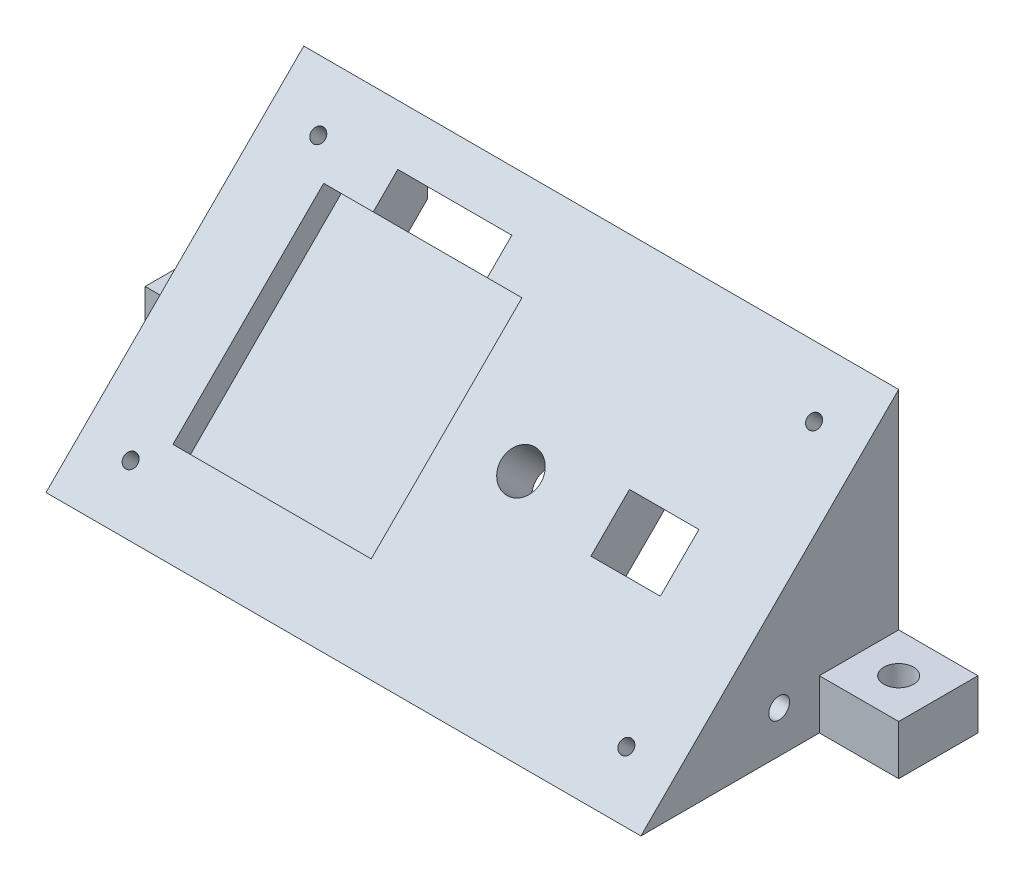
from build123d import *

# Parameters (mm, degrees)
EXTRUDE_3_DEPTH          = 120
SKETCH_4_R               = 4
SKETCH_4_W               = 14
SKETCH_4_H               = 11
CUT_EXTRUDE_1_DEPTH      = 120
CUT_EXTRUDE_2_DEPTH      = 5
SKETCH_5_W               = 23
SKETCH_5_H               = 7
CUT_EXTRUDE_3_DEPTH      = 98
SKETCH_6_W               = 100
SKETCH_6_H               = 53.539105243
CUT_EXTRUDE_4_DEPTH      = 98
SKETCH_7_R               = 1.4
CUT_EXTRUDE_5_DEPTH      = 5
SKETCH_13_W              = 16
SKETCH_13_H              = 16
SKETCH_13_R              = 3
EXTRUDE_8_DEPTH          = 10
CUT_EXTRUDE_7_DEPTH      = 155.609184721
CUT_EXTRUDE_7_DEPTH_BACK = 155.609184721
SKETCH_15_R              = 2.1


with BuildPart() as part:
    # Эскиз3 → Бобышка-Вытянуть3 (new body)
    with BuildSketch(Plane(origin=(0, 0, 0), x_dir=(0, 0, -1), z_dir=(1, 0, 0))):
        Polygon((0, 0), (52, 0), (52, 52), align=None)
    extrude(amount=EXTRUDE_3_DEPTH)

    # Эскиз4 → Вырез-Вытянуть1 (cut)
    with BuildSketch(Plane(origin=(0, 0, 0), x_dir=(1, 0, 0), z_dir=(0, 0.7071067811865477, 0.7071067811865475))):
        with Locations(Location((70, 36.5, 0), (0, 0, 270))):
            Circle(SKETCH_4_R)
        with Locations((95, 36.5)):
            Rectangle(SKETCH_4_W, SKETCH_4_H)
    extrude(amount=-CUT_EXTRUDE_1_DEPTH, mode=Mode.SUBTRACT)

    # Эскиз4<3> → Вырез-Вытянуть2 (cut)
    with BuildSketch(Plane(origin=(0, 0, 0), x_dir=(1, 0, 0), z_dir=(0, 0.7071067811865477, 0.7071067811865475))):
        Polygon((48, 58), (48, 65), (25, 65), (25, 58), (15, 58), (15, 15), (55, 15), (55, 58), align=None)
    extrude(amount=-CUT_EXTRUDE_2_DEPTH, mode=Mode.SUBTRACT)

    # Эскиз5 → Вырез-Вытянуть3 (cut)
    with BuildSketch(Plane(origin=(0, -3.535533906, -3.535533906), x_dir=(1, 0, 0), z_dir=(0, 0.7071067811865477, 0.7071067811865474))):
        with Locations((36.5, 61.5)):
            Rectangle(SKETCH_5_W, SKETCH_5_H)
    extrude(amount=-CUT_EXTRUDE_3_DEPTH, mode=Mode.SUBTRACT)

    # Эскиз6 → Вырез-Вытянуть4 (cut)
    with BuildSketch(Plane(origin=(0, -7.071067812, -7.071067812), x_dir=(1, 0, 0), z_dir=(0, 0.7071067811865477, 0.7071067811865474))):
        with Locations((60, 36.769552621)):
            Rectangle(SKETCH_6_W, SKETCH_6_H)
    extrude(amount=-CUT_EXTRUDE_4_DEPTH, mode=Mode.SUBTRACT)

    # Эскиз7 → Вырез-Вытянуть5 (cut)
    with BuildSketch(Plane(origin=(0, 0, 0), x_dir=(1, 0, 0), z_dir=(0, 0.7071067811865477, 0.7071067811865475))):
        with Locations(Location((10, 63.539105243, 0), (0, 0, 270))):
            Circle(SKETCH_7_R)
        with Locations(Location((110, 10, 0), (0, 0, 270))):
            Circle(SKETCH_7_R)
        with Locations(Location((110, 63.539105243, 0), (0, 0, 270))):
            Circle(SKETCH_7_R)
        with Locations(Location((10, 10, 0), (0, 0, 270))):
            Circle(SKETCH_7_R)
    extrude(amount=-CUT_EXTRUDE_5_DEPTH, mode=Mode.SUBTRACT)

    # Эскиз13 → Бобышка-Вытянуть8 (add)
    # profile 1 of 2: a face of its own
    with BuildSketch(Plane(origin=(0, 0, 0), x_dir=(-1, 0, 0), z_dir=(0, -1, 0))):
        with Locations((-128, 44)):
            Rectangle(SKETCH_13_W, SKETCH_13_H)
        with Locations(Location((-128, 44, 0), (0, 0, 90))):
            Circle(SKETCH_13_R, mode=Mode.SUBTRACT)
    # profile 2 of 2: a face of its own
    with BuildSketch(Plane(origin=(0, 0, 0), x_dir=(-1, 0, 0), z_dir=(0, -1, 0))):
        with Locations((8, 44)):
            Rectangle(SKETCH_13_W, SKETCH_13_H)
        with Locations(Location((8, 44, 0), (0, 0, 90))):
            Circle(SKETCH_13_R, mode=Mode.SUBTRACT)
    extrude(amount=-EXTRUDE_8_DEPTH)

    # Эскиз15 → Вырез-Вытянуть7 (cut, two sides: drawn at the far end of the back side and taken through both)
    with BuildSketch(Plane.ZY.offset(-CUT_EXTRUDE_7_DEPTH_BACK)):
        with Locations(Location((-27.888881523, 8.434002899, 0), (0, 0, 90))):
            Circle(SKETCH_15_R)
    extrude(amount=CUT_EXTRUDE_7_DEPTH + CUT_EXTRUDE_7_DEPTH_BACK, mode=Mode.SUBTRACT)


solid = part.part
